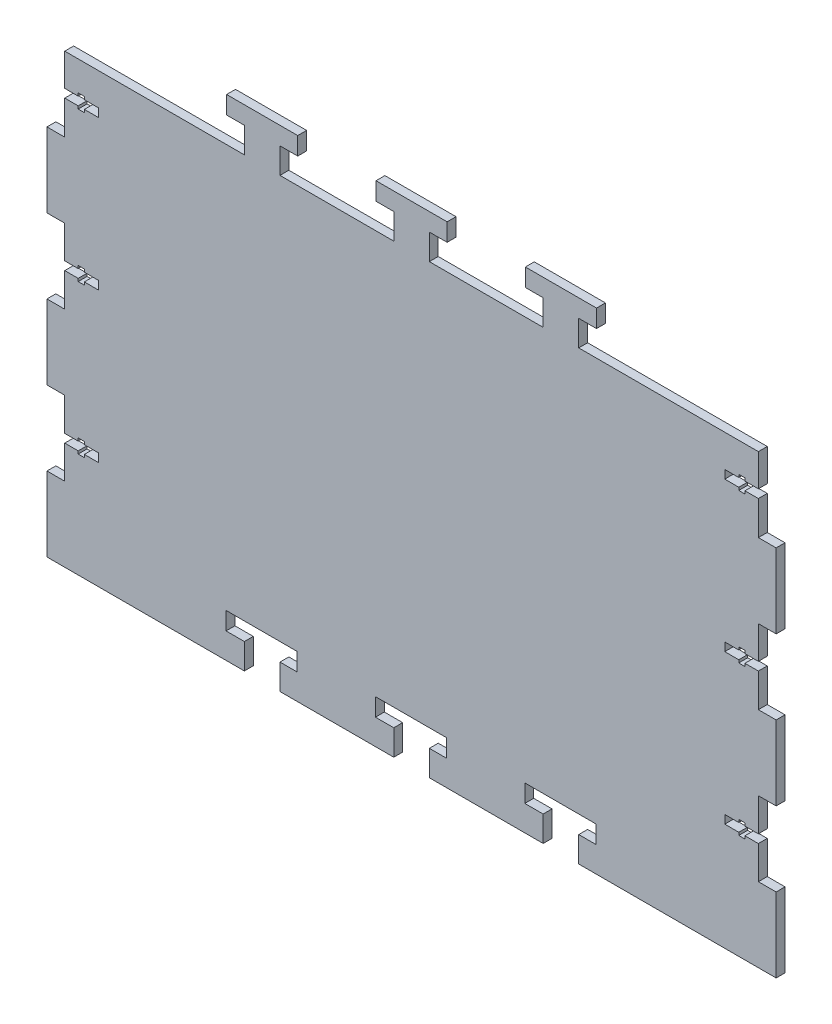
from build123d import *

# Parameters (mm, degrees)
SKETCH1_W           = 260.35
SKETCH1_H           = 159.592906802
BOSS_EXTRUDE1_DEPTH = 3.175
SKETCH2_W           = 3.175
SKETCH2_H           = 26.5988178
CUT_EXTRUDE1_DEPTH  = 6.35
LPATTERN1_COUNT     = 3
LPATTERN1_PITCH     = 53.19763554
SKETCH3_W           = 3.175
SKETCH3_H           = 26.59881777
CUT_EXTRUDE3_DEPTH  = 6.35
LPATTERN3_COUNT     = 3
LPATTERN3_PITCH     = 53.19763554
SKETCH5_W           = 3.175
SKETCH5_H           = 3
CUT_EXTRUDE4_DEPTH  = 12
SKETCH6_W           = 2.2
SKETCH6_H           = 3.175
CUT_EXTRUDE5_DEPTH  = 1
SKETCH8_W           = 2.2
SKETCH8_H           = 3.175
CUT_EXTRUDE6_DEPTH  = 1
LPATTERN5_COUNT     = 3
LPATTERN5_PITCH     = 53.34
SKETCH9_W           = 3.175
SKETCH9_H           = 3
CUT_EXTRUDE7_DEPTH  = 12
SKETCH10_W          = 2.2
SKETCH10_H          = 3.175
CUT_EXTRUDE8_DEPTH  = 1
SKETCH11_W          = 2.2
SKETCH11_H          = 3.175
CUT_EXTRUDE9_DEPTH  = 1
LPATTERN6_COUNT     = 3
LPATTERN6_PITCH     = 53.34
CUT_EXTRUDE10_DEPTH = 153.718974674
LPATTERN7_COUNT     = 2
LPATTERN7_PITCH     = 53.34
LPATTERN8_COUNT     = 2
LPATTERN8_PITCH     = 53.34
SKETCH15_W          = 12.7
SKETCH15_H          = 3.175
BOSS_EXTRUDE2_DEPTH = 9.144
SKETCH16_W          = 25.4
SKETCH16_H          = 3.175
BOSS_EXTRUDE3_DEPTH = 6.35
LPATTERN9_COUNT     = 2
LPATTERN9_PITCH     = 53.34
LPATTERN10_COUNT    = 2
LPATTERN10_PITCH    = 53.34


with BuildPart() as part:
    # Sketch1 → Boss-Extrude1 (new body)
    with BuildSketch(Plane.XY):
        Rectangle(SKETCH1_W, SKETCH1_H)
    extrude(amount=BOSS_EXTRUDE1_DEPTH)

    # Sketch2 → Cut-Extrude1 (cut)
    with BuildSketch(Plane.ZY.offset(130.175)):
        with Locations((1.5875, 66.497044501)):
            Rectangle(SKETCH2_W, SKETCH2_H)
    cut_extrude1 = extrude(amount=-CUT_EXTRUDE1_DEPTH, mode=Mode.SUBTRACT)

    # LPattern1: Cut-Extrude1 ×3
    with Locations(*[(0, -i * LPATTERN1_PITCH, 0) for i in range(1, LPATTERN1_COUNT)]):
        add(cut_extrude1, mode=Mode.SUBTRACT)

    # Sketch3 → Cut-Extrude3 (cut)
    with BuildSketch(Plane(origin=(130.175, 0, 0), x_dir=(0, 0, -1), z_dir=(1, 0, 0))):
        with Locations((-1.5875, -39.898226818)):
            Rectangle(SKETCH3_W, SKETCH3_H)
    cut_extrude3 = extrude(amount=-CUT_EXTRUDE3_DEPTH, mode=Mode.SUBTRACT)

    # LPattern3: Cut-Extrude3 ×3
    with Locations(*[(0, i * LPATTERN3_PITCH, 0) for i in range(1, LPATTERN3_COUNT)]):
        add(cut_extrude3, mode=Mode.SUBTRACT)

    # Sketch5 → Cut-Extrude4 (cut)
    with BuildSketch(Plane.ZY.offset(123.825)):
        with Locations((1.5875, -39.898226579)):
            Rectangle(SKETCH5_W, SKETCH5_H)
    cut_extrude4 = extrude(amount=-CUT_EXTRUDE4_DEPTH, mode=Mode.SUBTRACT)

    # Sketch6 → Cut-Extrude5 (cut)
    with BuildSketch(Plane.XZ.offset(38.398226579)):
        with Locations((-117.925, 1.5875)):
            Rectangle(SKETCH6_W, SKETCH6_H)
    cut_extrude5 = extrude(amount=-CUT_EXTRUDE5_DEPTH, mode=Mode.SUBTRACT)

    # Sketch8 → Cut-Extrude6 (cut)
    with BuildSketch(Plane(origin=(0, -41.398226579, 0), x_dir=(1, 0, 0), z_dir=(0, 1, 0))):
        with Locations((-117.925, -1.5875)):
            Rectangle(SKETCH8_W, SKETCH8_H)
    cut_extrude6 = extrude(amount=-CUT_EXTRUDE6_DEPTH, mode=Mode.SUBTRACT)

    # LPattern5: Cut-Extrude4, Cut-Extrude5, Cut-Extrude6 ×3
    with Locations(*[(0, i * LPATTERN5_PITCH, 0) for i in range(1, LPATTERN5_COUNT)]):
        add(cut_extrude4, mode=Mode.SUBTRACT)
        add(cut_extrude5, mode=Mode.SUBTRACT)
        add(cut_extrude6, mode=Mode.SUBTRACT)

    # Sketch9 → Cut-Extrude7 (cut)
    with BuildSketch(Plane(origin=(123.825, 0, 0), x_dir=(0, 0, -1), z_dir=(1, 0, 0))):
        with Locations((-1.5875, -39.898226818)):
            Rectangle(SKETCH9_W, SKETCH9_H)
    cut_extrude7 = extrude(amount=-CUT_EXTRUDE7_DEPTH, mode=Mode.SUBTRACT)

    # Sketch10 → Cut-Extrude8 (cut)
    with BuildSketch(Plane.XZ.offset(38.398226818)):
        with Locations((117.925, 1.5875)):
            Rectangle(SKETCH10_W, SKETCH10_H)
    cut_extrude8 = extrude(amount=-CUT_EXTRUDE8_DEPTH, mode=Mode.SUBTRACT)

    # Sketch11 → Cut-Extrude9 (cut)
    with BuildSketch(Plane(origin=(0, -41.398226818, 0), x_dir=(1, 0, 0), z_dir=(0, 1, 0))):
        with Locations((117.925, -1.5875)):
            Rectangle(SKETCH11_W, SKETCH11_H)
    cut_extrude9 = extrude(amount=-CUT_EXTRUDE9_DEPTH, mode=Mode.SUBTRACT)

    # LPattern6: Cut-Extrude7, Cut-Extrude8, Cut-Extrude9 ×3
    with Locations(*[(0, i * LPATTERN6_PITCH, 0) for i in range(1, LPATTERN6_COUNT)]):
        add(cut_extrude7, mode=Mode.SUBTRACT)
        add(cut_extrude8, mode=Mode.SUBTRACT)
        add(cut_extrude9, mode=Mode.SUBTRACT)

    # Sketch4 → Cut-Extrude10 (cut, through all)
    with BuildSketch(Plane.XY.offset(3.175)):
        Polygon((-6.35, -79.796453401), (-6.35, -70.685115582), (-12.899606221, -70.685115582), (-12.899606221, -64.335115582), (12.500393779, -64.335115582), (12.500393779, -70.685115582), (6.35, -70.685115582), (6.35, -79.796453401), align=None)
    cut_extrude10 = extrude(amount=-CUT_EXTRUDE10_DEPTH, mode=Mode.SUBTRACT)

    # LPattern7: Cut-Extrude10 ×2
    with Locations(*[(-i * LPATTERN7_PITCH, 0, 0) for i in range(1, LPATTERN7_COUNT)]):
        add(cut_extrude10, mode=Mode.SUBTRACT)

    # LPattern8: Cut-Extrude10 ×2
    with Locations(*[(i * LPATTERN8_PITCH, 0, 0) for i in range(1, LPATTERN8_COUNT)]):
        add(cut_extrude10, mode=Mode.SUBTRACT)

    # Sketch15 → Boss-Extrude2 (add)
    with BuildSketch(Plane(origin=(0, 79.796453401, 0), x_dir=(1, 0, 0), z_dir=(0, 1, 0))):
        with Locations((0, -1.5875)):
            Rectangle(SKETCH15_W, SKETCH15_H)
    boss_extrude2 = extrude(amount=BOSS_EXTRUDE2_DEPTH)

    # Sketch16 → Boss-Extrude3 (add)
    with BuildSketch(Plane(origin=(0, 88.940453401, 0), x_dir=(1, 0, 0), z_dir=(0, 1, 0))):
        with Locations((0, -1.5875)):
            Rectangle(SKETCH16_W, SKETCH16_H)
    boss_extrude3 = extrude(amount=BOSS_EXTRUDE3_DEPTH)

    # LPattern9: Boss-Extrude2, Boss-Extrude3 ×2
    with Locations(*[(i * LPATTERN9_PITCH, 0, 0) for i in range(1, LPATTERN9_COUNT)]):
        add(boss_extrude2)
        add(boss_extrude3)

    # LPattern10: Boss-Extrude2, Boss-Extrude3 ×2
    with Locations(*[(-i * LPATTERN10_PITCH, 0, 0) for i in range(1, LPATTERN10_COUNT)]):
        add(boss_extrude2)
        add(boss_extrude3)


solid = part.part
